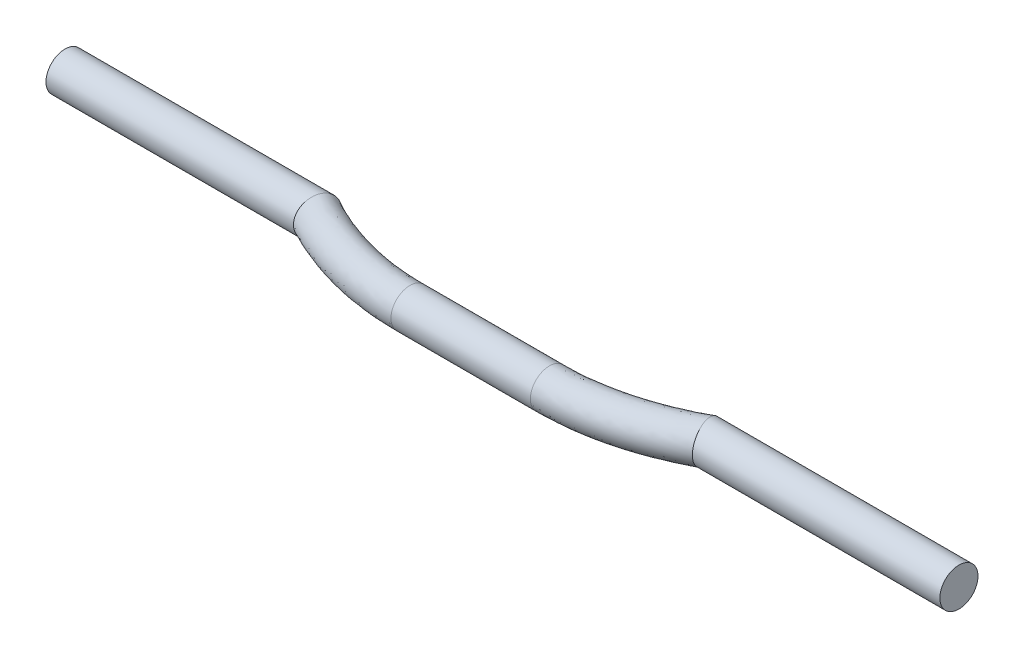
from build123d import *

# Parameters (mm, degrees)
SKETCH2_R = 12.85


with BuildPart() as part:
    # Sweep1: sweep along a path in Sketch1
    with BuildLine() as sweep1_path:  # in the path sketch's own coordinates; laid on its plane below (add() does not lay a ready-made edge on the line's plane)
        Line((301.307150881, 29.86530187), (131.307150881, 29.86530187))
        add(Edge.make_bspline(
            [(131.307150881, 29.86530187), (90.533603326, 8.116674685), (47, 8.116674685)],
            knots=[0, 0, 0, 1, 1, 1], degree=2))
        Line((47, 8.116674685), (0, 8.116674685))
    # Sketch2 → Sweep1 (sweep)
    with BuildSketch(Plane(origin=(301.307150881, 0, 0), x_dir=(0, 0, -1), z_dir=(1, 0, 0))):
        with Locations((29.86530187, 0)):
            Circle(SKETCH2_R)
    sweep1 = sweep(path=Plane(origin=(0, 0, 0), x_dir=(1, 0, 0), z_dir=(0, 1, 0)) * sweep1_path.line, transition=Transition.RIGHT)

    # Mirror1: Sweep1 across plane
    add(sweep1.mirror(Plane(origin=(0, 0, 0), x_dir=(0, 0, 1), z_dir=(1, 0, 0))))


solid = part.part
